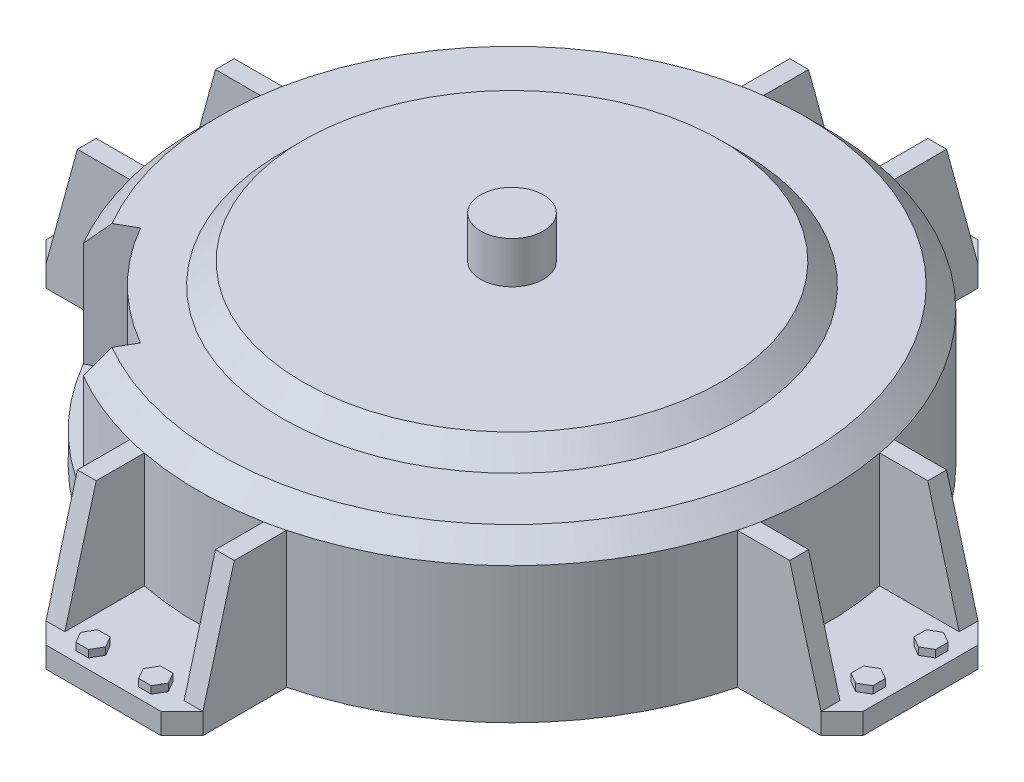
from build123d import *

# Parameters (mm, degrees)
SKETCH1_R                    = 150
BOSS_EXTRUDE1_DEPTH          = 75
CHAMFER1_SIZE                = 10
BOSS_EXTRUDE2_START          = -75
SKETCH2_R                    = 150
BOSS_EXTRUDE2_DEPTH          = 10
CHAMFER2_SIZE                = 10
CHAMFER3_SIZE                = 10
BOSS_EXTRUDE3_DEPTH          = 9
BOSS_EXTRUDE4_DEPTH          = 3.5
CIRPATTERN1_COUNT            = 4
CIRPATTERN1_COPY_1_DEPTH     = 9
CIRPATTERN1_COPY_2_DEPTH     = 9
CIRPATTERN1_COPY_3_DEPTH     = 9
CIRPATTERN1_COPY_4_DEPTH     = 3.5
CIRPATTERN1_COPY_5_DEPTH     = 3.5
CIRPATTERN1_COPY_6_DEPTH     = 3.5
CHAMFER2_OF_CIRPATTERN1_SIZE = 10
CHAMFER3_OF_CIRPATTERN1_SIZE = 10
CUT_EXTRUDE1_START           = -60
CUT_EXTRUDE1_DEPTH           = 60
SKETCH7_R                    = 110
BOSS_EXTRUDE5_DEPTH          = 10
BOSS_EXTRUDE5_TAPER          = 45
SKETCH8_R                    = 15
BOSS_EXTRUDE6_DEPTH          = 20


with BuildPart() as part:
    # Sketch1 → Boss-Extrude1 (new body)
    with BuildSketch(Plane(origin=(0, 0, 0), x_dir=(1, 0, 0), z_dir=(0, 1, 0))):
        with Locations(Location((0, 0, 0), (0, 0, 270))):
            Circle(SKETCH1_R)
    extrude(amount=BOSS_EXTRUDE1_DEPTH)

    # Chamfer1
    chamfer1_edges = [part.edges().sort_by_distance(p)[0] for p in [
        (0, 75, -150),
    ]]
    chamfer(chamfer1_edges, length=CHAMFER1_SIZE)

    # Sketch2 → Boss-Extrude2 (add)
    with BuildSketch(Plane(origin=(0, 75, 0), x_dir=(1, 0, 0), z_dir=(0, 1, 0)).offset(BOSS_EXTRUDE2_START)):
        with Locations(Location((0, 0, 0), (0, 0, 165.522487814))):
            Circle(SKETCH2_R)
        with BuildLine():
            Line((-145.236875483, 37.5), (-195.236875483, 37.5))
            Line((-195.236875483, 37.5), (-195.236875483, -37.5))
            Line((-195.236875483, -37.5), (-145.236875483, -37.5))
            ThreePointArc((-145.236875483, -37.5), (-150, 0), (-145.236875483, 37.5))
        make_face()
    boss_extrude2 = extrude(amount=BOSS_EXTRUDE2_DEPTH)

    # Chamfer2
    chamfer2_edges = [part.edges().sort_by_distance(p)[0] for p in [
        (-195.236875483, 5, 37.5),
    ]]
    chamfer(chamfer2_edges, length=CHAMFER2_SIZE)

    # Chamfer3
    chamfer3_edges = [part.edges().sort_by_distance(p)[0] for p in [
        (-195.236875483, 5, -37.5),
    ]]
    chamfer(chamfer3_edges, length=CHAMFER3_SIZE)

    # Sketch3 → Boss-Extrude3 (add)
    with BuildSketch(Plane.XY.offset(37.5)):
        Polygon((-185.236875483, 10), (-145.236875483, 10), (-145.236875483, 65), (-170.236875483, 65), align=None)
    boss_extrude3 = extrude(amount=-BOSS_EXTRUDE3_DEPTH)

    # Sketch4 → Boss-Extrude4 (add)
    with BuildSketch(Plane(origin=(0, 10, 0), x_dir=(1, 0, 0), z_dir=(0, 1, 0))):
        Polygon((-180.04072306, -12), (-185.236875483, -9), (-190.433027905, -12), (-190.433027905, -18), (-185.236875483, -21), (-180.04072306, -18), align=None)
    boss_extrude4 = extrude(amount=BOSS_EXTRUDE4_DEPTH)

    # Mirror1: Boss-Extrude3, Boss-Extrude4 across plane
    add(boss_extrude3.mirror(Plane.XY))
    add(boss_extrude4.mirror(Plane.XY))

    # CirPattern1: Boss-Extrude2, Boss-Extrude3, Boss-Extrude4 ×4 about axis
    cirpattern1_axis = Axis((0, 0, 0), (0, 1, 0))
    add([boss_extrude2.rotate(cirpattern1_axis, i * 360 / CIRPATTERN1_COUNT) for i in range(1, CIRPATTERN1_COUNT)])
    add([boss_extrude3.rotate(cirpattern1_axis, i * 360 / CIRPATTERN1_COUNT) for i in range(1, CIRPATTERN1_COUNT)])
    add([boss_extrude4.rotate(cirpattern1_axis, i * 360 / CIRPATTERN1_COUNT) for i in range(1, CIRPATTERN1_COUNT)])

    # CirPattern1 copy 1 sketch → CirPattern1 copy 1 (add)
    with BuildSketch(Plane(origin=(-37.5, 0, 0), x_dir=(0, 0, -1), z_dir=(-1, 0, 0))):
        Polygon((-185.236875483, -10), (-145.236875483, -10), (-145.236875483, -65), (-170.236875483, -65), align=None)
    extrude(amount=-CIRPATTERN1_COPY_1_DEPTH)

    # CirPattern1 copy 2 sketch → CirPattern1 copy 2 (add)
    with BuildSketch(Plane(origin=(0, 0, 37.5), x_dir=(-1, 0, 0), z_dir=(0, 0, 1))):
        Polygon((-185.236875483, -10), (-145.236875483, -10), (-145.236875483, -65), (-170.236875483, -65), align=None)
    extrude(amount=-CIRPATTERN1_COPY_2_DEPTH)

    # CirPattern1 copy 3 sketch → CirPattern1 copy 3 (add)
    with BuildSketch(Plane(origin=(37.5, 0, 0), x_dir=(0, 0, 1), z_dir=(1, 0, 0))):
        Polygon((-185.236875483, -10), (-145.236875483, -10), (-145.236875483, -65), (-170.236875483, -65), align=None)
    extrude(amount=-CIRPATTERN1_COPY_3_DEPTH)

    # CirPattern1 copy 4 sketch → CirPattern1 copy 4 (add)
    with BuildSketch(Plane(origin=(0, 10, 0), x_dir=(0, 0, -1), z_dir=(0, 1, 0))):
        Polygon((-180.04072306, 12), (-185.236875483, 9), (-190.433027905, 12), (-190.433027905, 18), (-185.236875483, 21), (-180.04072306, 18), align=None)
    extrude(amount=CIRPATTERN1_COPY_4_DEPTH)

    # CirPattern1 copy 5 sketch → CirPattern1 copy 5 (add)
    with BuildSketch(Plane(origin=(0, 10, 0), x_dir=(-1, 0, 0), z_dir=(0, 1, 0))):
        Polygon((-180.04072306, 12), (-185.236875483, 9), (-190.433027905, 12), (-190.433027905, 18), (-185.236875483, 21), (-180.04072306, 18), align=None)
    extrude(amount=CIRPATTERN1_COPY_5_DEPTH)

    # CirPattern1 copy 6 sketch → CirPattern1 copy 6 (add)
    with BuildSketch(Plane.ZX.offset(10)):
        Polygon((-180.04072306, 12), (-185.236875483, 9), (-190.433027905, 12), (-190.433027905, 18), (-185.236875483, 21), (-180.04072306, 18), align=None)
    extrude(amount=CIRPATTERN1_COPY_6_DEPTH)

    # Chamfer2 of CirPattern1
    chamfer2_of_cirpattern1_edges = [part.edges().sort_by_distance(p)[0] for p in [
        (37.5, 5, 195.236875483),
        (195.236875483, 5, -37.5),
        (-37.5, 5, -195.236875483),
    ]]
    chamfer(chamfer2_of_cirpattern1_edges, length=CHAMFER2_OF_CIRPATTERN1_SIZE)

    # Chamfer3 of CirPattern1
    chamfer3_of_cirpattern1_edges = [part.edges().sort_by_distance(p)[0] for p in [
        (-37.5, 5, 195.236875483),
        (195.236875483, 5, 37.5),
        (37.5, 5, -195.236875483),
    ]]
    chamfer(chamfer3_of_cirpattern1_edges, length=CHAMFER3_OF_CIRPATTERN1_SIZE)

    # Sketch5 → Cut-Extrude1 (cut)
    with BuildSketch(Plane(origin=(0, 75, 0), x_dir=(1, 0, 0), z_dir=(0, 1, 0)).offset(CUT_EXTRUDE1_START)):
        with BuildLine():
            ThreePointArc((-70, -121.24355653), (-98.994949366, -98.994949366), (-121.24355653, -70))
            Line((-121.24355653, -70), (-129.903810568, -75))
            ThreePointArc((-129.903810568, -75), (-106.066017178, -106.066017178), (-75, -129.903810568))
            Line((-75, -129.903810568), (-70, -121.24355653))
        make_face()
        with BuildLine():
            ThreePointArc((-65, -112.583302492), (-91.923881554, -91.923881554), (-112.583302492, -65))
            Line((-112.583302492, -65), (-121.24355653, -70))
            ThreePointArc((-121.24355653, -70), (-98.994949366, -98.994949366), (-70, -121.24355653))
            Line((-70, -121.24355653), (-65, -112.583302492))
        make_face()
    extrude(amount=CUT_EXTRUDE1_DEPTH, mode=Mode.SUBTRACT)

    # Sketch7 → Boss-Extrude5 (add)
    with BuildSketch(Plane(origin=(0, 75, 0), x_dir=(1, 0, 0), z_dir=(0, 1, 0))):
        Circle(SKETCH7_R)
    extrude(amount=BOSS_EXTRUDE5_DEPTH, taper=BOSS_EXTRUDE5_TAPER)

    # Sketch8 → Boss-Extrude6 (add)
    with BuildSketch(Plane(origin=(0, 85, 0), x_dir=(1, 0, 0), z_dir=(0, 1, 0))):
        with Locations(Location((0, 0, 0), (0, 0, 270))):
            Circle(SKETCH8_R)
    extrude(amount=BOSS_EXTRUDE6_DEPTH)


solid = part.part
